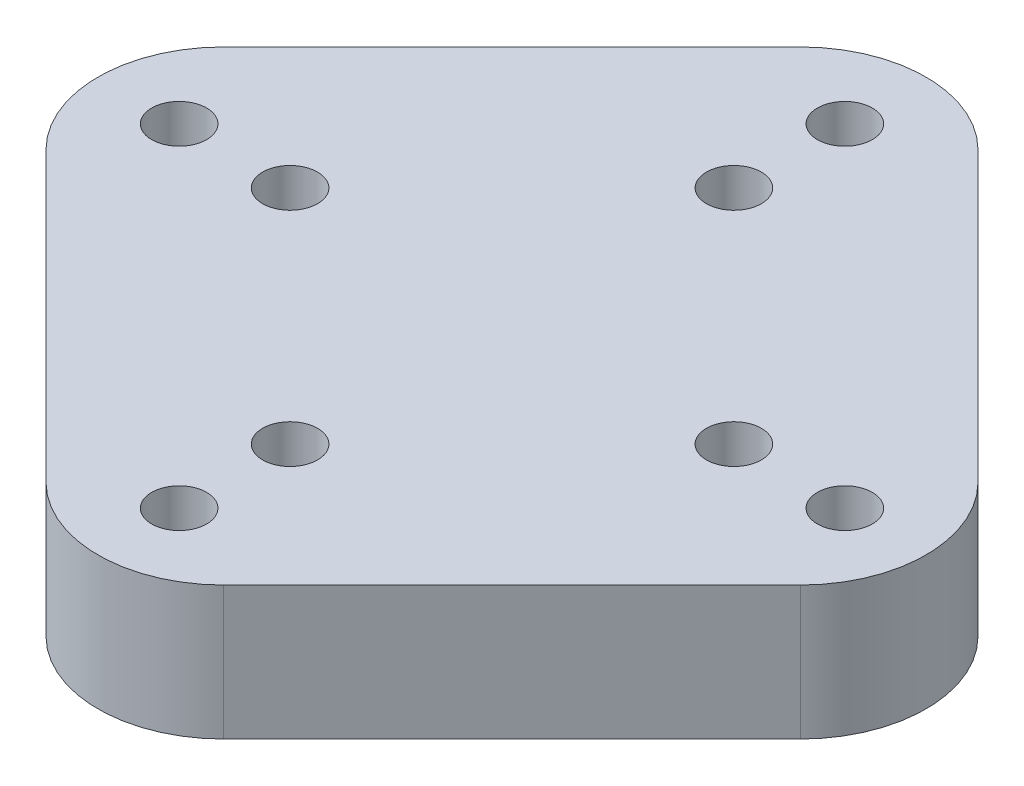
from build123d import *

# Parameters (mm, degrees)
SKETCH_1_R      = 1.75
EXTRUDE_1_DEPTH = 8.5


with BuildPart() as part:
    # Эскиз1 → Бобышка-Вытянуть1 (new body)
    with BuildSketch(Plane(origin=(0, 0, 0), x_dir=(1, 0, 0), z_dir=(0, 1, 0))):
        with BuildLine():
            Line((5.656854249, -24.04163056), (24.04163056, -5.656854249))
            ThreePointArc((24.04163056, -5.656854249), (26.384776311, 0), (24.04163056, 5.656854249))
            Line((24.04163056, 5.656854249), (5.656854249, 24.04163056))
            ThreePointArc((5.656854249, 24.04163056), (0, 26.384776311), (-5.656854249, 24.04163056))
            Line((-5.656854249, 24.04163056), (-24.04163056, 5.656854249))
            ThreePointArc((-24.04163056, 5.656854249), (-26.384776311, 0), (-24.04163056, -5.656854249))
            Line((-24.04163056, -5.656854249), (-5.656854249, -24.04163056))
            ThreePointArc((-5.656854249, -24.04163056), (0, -26.384776311), (5.656854249, -24.04163056))
        make_face()
        with Locations(Location((21.213203436, 0, 0), (0, 0, 270))):
            Circle(SKETCH_1_R, mode=Mode.SUBTRACT)
        with Locations(Location((14.142135624, 0, 0), (0, 0, 270))):
            Circle(SKETCH_1_R, mode=Mode.SUBTRACT)
        with Locations(Location((0, -14.142135624, 0), (0, 0, 270))):
            Circle(SKETCH_1_R, mode=Mode.SUBTRACT)
        with Locations(Location((0, -21.213203436, 0), (0, 0, 270))):
            Circle(SKETCH_1_R, mode=Mode.SUBTRACT)
        with Locations(Location((-14.142135624, 0, 0), (0, 0, 270))):
            Circle(SKETCH_1_R, mode=Mode.SUBTRACT)
        with Locations(Location((-21.213203436, 0, 0), (0, 0, 270))):
            Circle(SKETCH_1_R, mode=Mode.SUBTRACT)
        with Locations(Location((0, 14.142135624, 0), (0, 0, 270))):
            Circle(SKETCH_1_R, mode=Mode.SUBTRACT)
        with Locations(Location((0, 21.213203436, 0), (0, 0, 270))):
            Circle(SKETCH_1_R, mode=Mode.SUBTRACT)
    extrude(amount=EXTRUDE_1_DEPTH)


solid = part.part
